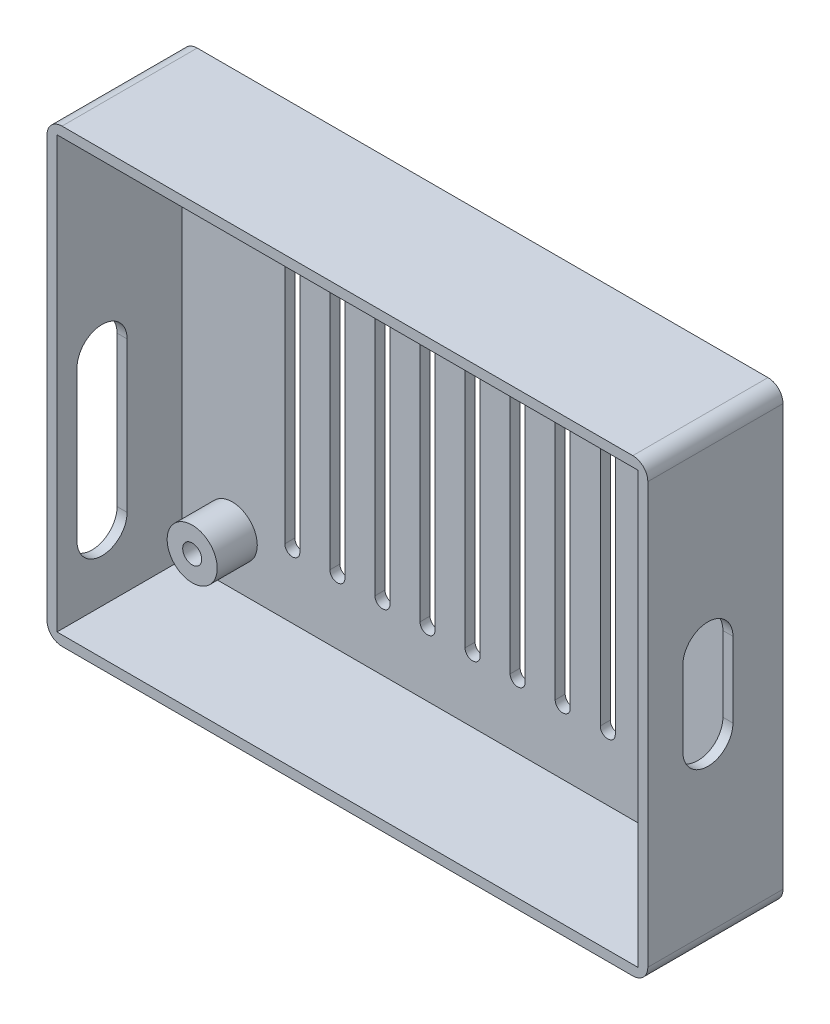
from build123d import *

# Parameters (mm, degrees)
ESQUISSE2_W                                      = 120
ESQUISSE2_H                                      = 90
BOSS_EXTRU_1_DEPTH                               = 2
ESQUISSE3_R                                      = 5
BOSS_EXTRU_2_DEPTH                               = 8
CHAMBRAGE_POUR_VIS_T_TE_RONDE_BOMB_E_D           = 3.7973
CHAMBRAGE_POUR_VIS_T_TE_RONDE_BOMB_E_CBORE_D     = 7.54126
CHAMBRAGE_POUR_VIS_T_TE_RONDE_BOMB_E_CBORE_DEPTH = 2.4638
R_P_TITION_LIN_AIRE1_COUNT                       = 2
R_P_TITION_LIN_AIRE1_PITCH                       = 96
R_P_TITION_LIN_AIRE1_COUNT_DIR2                  = 2
R_P_TITION_LIN_AIRE1_PITCH_DIR2                  = 66
ENL_V_MAT_EXTRU_1_DEPTH                          = 8
R_P_TITION_LIN_AIRE2_COUNT                       = 5
R_P_TITION_LIN_AIRE2_PITCH                       = 9
R_P_TITION_LIN_AIRE2_COL_COUNT                   = 5
R_P_TITION_LIN_AIRE2_COL_PITCH                   = 9
ESQUISSE8_W                                      = 120
ESQUISSE8_H                                      = 90
ESQUISSE8_W_2                                    = 116
ESQUISSE8_H_2                                    = 86
BOSS_EXTRU_3_DEPTH                               = 25
ENL_V_MAT_EXTRU_2_REACH                          = 132.973
ENL_V_MAT_EXTRU_3_DEPTH                          = 2
CONG_1_R                                         = 3


with BuildPart() as part:
    # Esquisse2 → Boss.-Extru.1 (new body)
    with BuildSketch(Plane.XY):
        Rectangle(ESQUISSE2_W, ESQUISSE2_H)
    extrude(amount=BOSS_EXTRU_1_DEPTH)

    # Esquisse3 → Boss.-Extru.2 (add)
    with BuildSketch(Plane.XY.offset(2)):
        with Locations((-48, 33)):
            Circle(ESQUISSE3_R)
        with Locations((48, 33)):
            Circle(ESQUISSE3_R)
        with Locations((48, -33)):
            Circle(ESQUISSE3_R)
        with Locations((-48, -33)):
            Circle(ESQUISSE3_R)
    extrude(amount=BOSS_EXTRU_2_DEPTH)

    # Chambrage pour vis à tête ronde bombée #61 (through all)
    with Locations(Plane(origin=(0, 0, 0), x_dir=(-1, 0, 0), z_dir=(0, 0, -1))):
        with Locations((48, -33)):
            chambrage_pour_vis_t_te_ronde_bomb_e = CounterBoreHole(CHAMBRAGE_POUR_VIS_T_TE_RONDE_BOMB_E_D / 2, CHAMBRAGE_POUR_VIS_T_TE_RONDE_BOMB_E_CBORE_D / 2, CHAMBRAGE_POUR_VIS_T_TE_RONDE_BOMB_E_CBORE_DEPTH)

    # Répétition linéaire1: Chambrage pour vis _ t_te ronde bomb_e 2 × 2
    with Locations(*[(i * R_P_TITION_LIN_AIRE1_PITCH, j * R_P_TITION_LIN_AIRE1_PITCH_DIR2, 0) for i in range(R_P_TITION_LIN_AIRE1_COUNT) for j in range(R_P_TITION_LIN_AIRE1_COUNT_DIR2) if (i, j) != (0, 0)]):
        add(chambrage_pour_vis_t_te_ronde_bomb_e, mode=Mode.SUBTRACT)

    # Esquisse7 → Enlèv. mat.-Extru.1 (cut)
    with BuildSketch(Plane.XY.offset(2)):
        with BuildLine():
            Line((-1.5, -30), (-1.5, 30))
            ThreePointArc((-1.5, 30), (0, 31.5), (1.5, 30))
            Line((1.5, 30), (1.5, -30))
            ThreePointArc((1.5, -30), (0, -31.5), (-1.5, -30))
        make_face()
    enl_v_mat_extru_1 = extrude(amount=-ENL_V_MAT_EXTRU_1_DEPTH, mode=Mode.SUBTRACT)

    # Répétition linéaire2: Enlèv. mat.-Extru.1 ×5
    with Locations(*[(-i * R_P_TITION_LIN_AIRE2_PITCH, 0, 0) for i in range(1, R_P_TITION_LIN_AIRE2_COUNT)]):
        add(enl_v_mat_extru_1, mode=Mode.SUBTRACT)

    # Répétition linéaire2 col: Enlèv. mat.-Extru.1 ×5
    with Locations(*[(i * R_P_TITION_LIN_AIRE2_COL_PITCH, 0, 0) for i in range(1, R_P_TITION_LIN_AIRE2_COL_COUNT)]):
        add(enl_v_mat_extru_1, mode=Mode.SUBTRACT)

    # Esquisse8 → Boss.-Extru.3 (add)
    with BuildSketch(Plane.XY.offset(2)):
        Rectangle(ESQUISSE8_W, ESQUISSE8_H)
        Rectangle(ESQUISSE8_W_2, ESQUISSE8_H_2, mode=Mode.SUBTRACT)
    extrude(amount=BOSS_EXTRU_3_DEPTH)

    # Esquisse9 → Enlèv. mat.-Extru.2 (cut, up to next)
    with BuildSketch(Plane.ZY.offset(60), mode=Mode.PRIVATE) as enl_v_mat_extru_2_sk1:
        with BuildLine():
            Line((23, 0.689181082), (23, -29.310818918))
            ThreePointArc((23, -29.310818918), (18, -34.310818918), (13, -29.310818918))
            Line((13, -29.310818918), (13, 0.689181082))
            ThreePointArc((13, 0.689181082), (18, 5.689181082), (23, 0.689181082))
        make_face()
    enl_v_mat_extru_2_tool1 = extrude(enl_v_mat_extru_2_sk1.sketch, amount=-ENL_V_MAT_EXTRU_2_REACH, mode=Mode.PRIVATE) & part.part
    add(enl_v_mat_extru_2_tool1.solids().sort_by_distance((-60, -14.310819, 18))[0], mode=Mode.SUBTRACT)

    # Esquisse10 → Enlèv. mat.-Extru.3 (cut)
    with BuildSketch(Plane(origin=(60, 0, 0), x_dir=(0, 0, -1), z_dir=(1, 0, 0))):
        with BuildLine():
            Line((-20, -8.249494847), (-20, 6.750505153))
            ThreePointArc((-20, 6.750505153), (-15, 11.750505153), (-10, 6.750505153))
            Line((-10, 6.750505153), (-10, -8.249494847))
            ThreePointArc((-10, -8.249494847), (-15, -13.249494847), (-20, -8.249494847))
        make_face()
    extrude(amount=-ENL_V_MAT_EXTRU_3_DEPTH, mode=Mode.SUBTRACT)

    # Congé1
    cong_1_edges = [part.edges().sort_by_distance(p)[0] for p in [
        (-60, 45, 13.5),
        (60, 45, 13.5),
        (60, -45, 13.5),
        (-60, -45, 13.5),
    ]]
    fillet(cong_1_edges, radius=CONG_1_R)


solid = part.part
